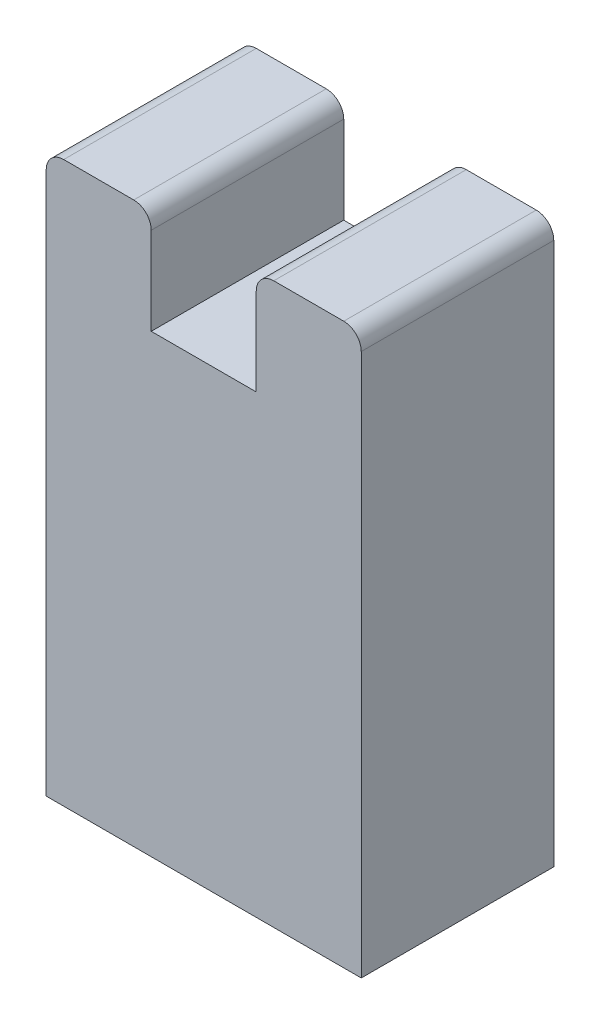
from build123d import *

# Parameters (mm, degrees)
SKETCH_1_W          = 9
SKETCH_1_H          = 16
EXTRUDE_1_DEPTH     = 5.5
SKETCH_2_W          = 3
SKETCH_2_H          = 3
CUT_EXTRUDE_1_DEPTH = 20.163767897
FILLET_1_R          = 0.5


with BuildPart() as part:
    # ｽｹｯﾁ1 → ﾎﾞｽ - 押し出し1 (new body)
    with BuildSketch(Plane.XY):
        with Locations((4.5, 8)):
            Rectangle(SKETCH_1_W, SKETCH_1_H)
    extrude(amount=EXTRUDE_1_DEPTH)

    # ｽｹｯﾁ2 → ｶｯﾄ - 押し出し1 (cut, through all)
    with BuildSketch(Plane.XY.offset(5.5)):
        with Locations((4.5, 14.5)):
            Rectangle(SKETCH_2_W, SKETCH_2_H)
    extrude(amount=-CUT_EXTRUDE_1_DEPTH, mode=Mode.SUBTRACT)

    # ﾌｨﾚｯﾄ1
    fillet_1_edges = [part.edges().sort_by_distance(p)[0] for p in [
        (3, 16, 2.75),
        (6, 16, 2.75),
        (0, 16, 2.75),
        (9, 16, 2.75),
    ]]
    fillet(fillet_1_edges, radius=FILLET_1_R)


solid = part.part
